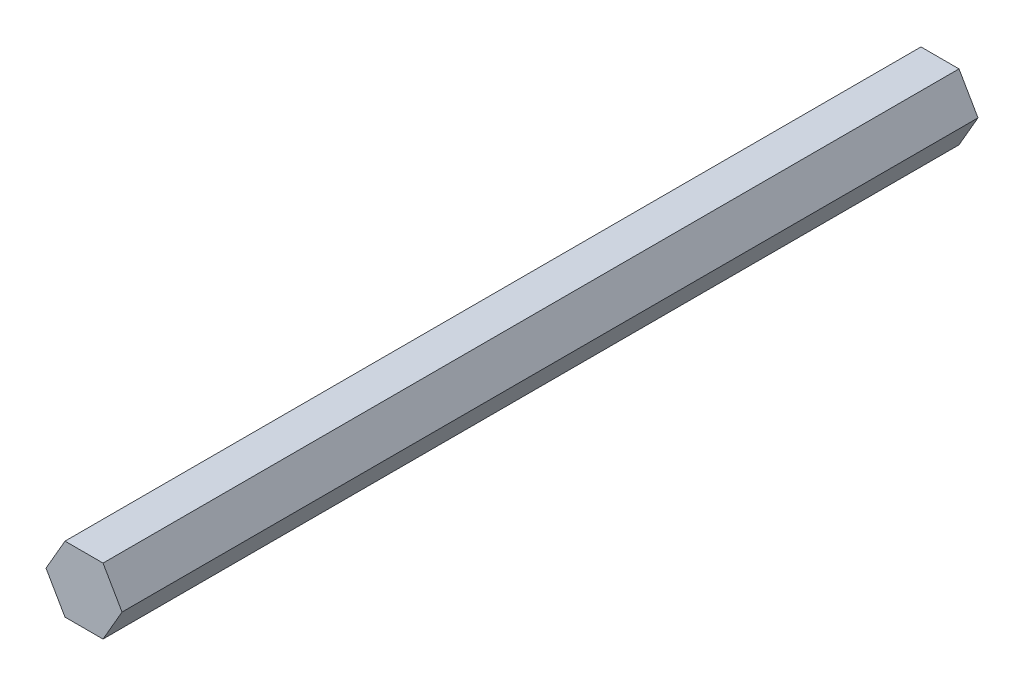
from build123d import *

# Parameters (mm, degrees)
BOSS_EXTRUDE1_DEPTH = 165.1


with BuildPart() as part:
    # Sketch1 → Boss-Extrude1 (new body)
    with BuildSketch(Plane.XY):
        Polygon((3.663549428, -6.351514695), (7.332347792, -0.003030475), (3.668798364, 6.34848422), (-3.663549428, 6.351514695), (-7.332347792, 0.003030475), (-3.668798364, -6.34848422), align=None)
    extrude(amount=BOSS_EXTRUDE1_DEPTH)


solid = part.part
